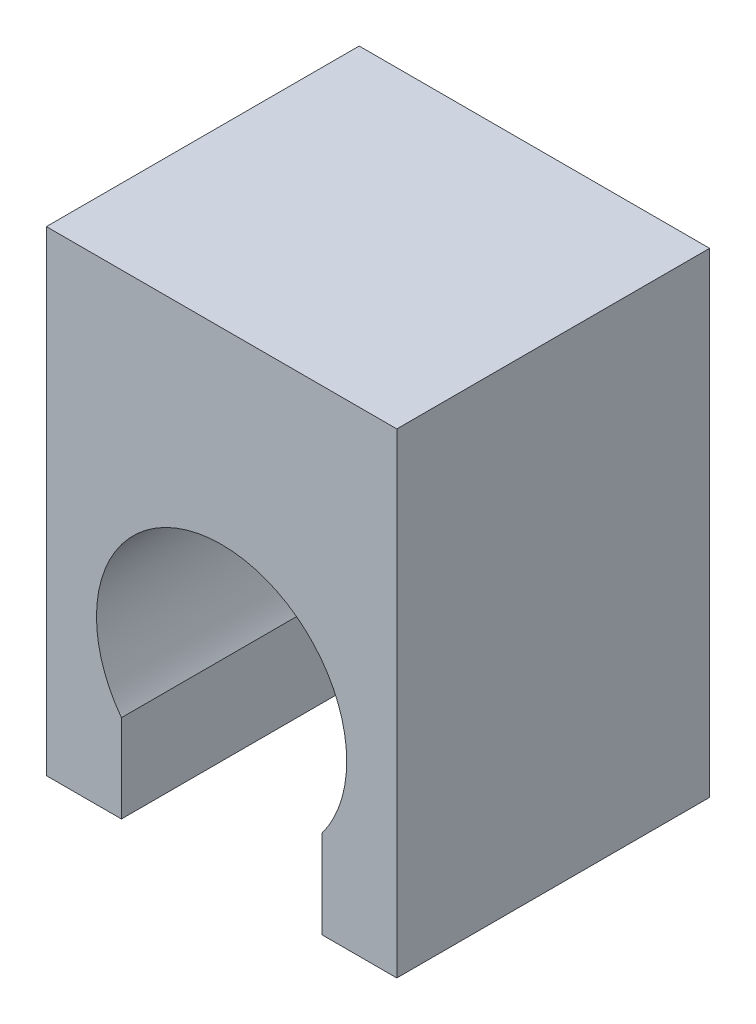
from build123d import *

# Parameters (mm, degrees)
BOSS_EXTRUDE1_DEPTH = 10
SKETCH2_W           = 11.202256629
SKETCH2_H           = 10
BOSS_EXTRUDE2_DEPTH = 4


with BuildPart() as part:
    # Sketch1 → Boss-Extrude1 (new body)
    with BuildSketch(Plane.XY):
        with BuildLine():
            Line((-4.000846014, 2.113625207), (-6.3997177, 2.113625207))
            Line((-6.3997177, 2.113625207), (-6.3997177, 13.316105715))
            Line((-6.3997177, 13.316105715), (4.802538929, 13.316105715))
            Line((4.802538929, 13.316105715), (4.802538929, 2.113625207))
            Line((4.802538929, 2.113625207), (2.403667244, 2.113625207))
            Line((2.403667244, 2.113625207), (2.403667244, 4.919117505))
            ThreePointArc((2.403667244, 4.919117505), (-0.798589385, 11.316105715), (-4.000846014, 4.919117505))
            Line((-4.000846014, 4.919117505), (-4.000846014, 2.113625207))
        make_face()
    extrude(amount=BOSS_EXTRUDE1_DEPTH)

    # Sketch2 → Boss-Extrude2 (add)
    with BuildSketch(Plane(origin=(0, 13.316105715, 0), x_dir=(1, 0, 0), z_dir=(0, 1, 0))):
        with Locations((-0.798589385, -5)):
            Rectangle(SKETCH2_W, SKETCH2_H)
    extrude(amount=BOSS_EXTRUDE2_DEPTH)


solid = part.part
